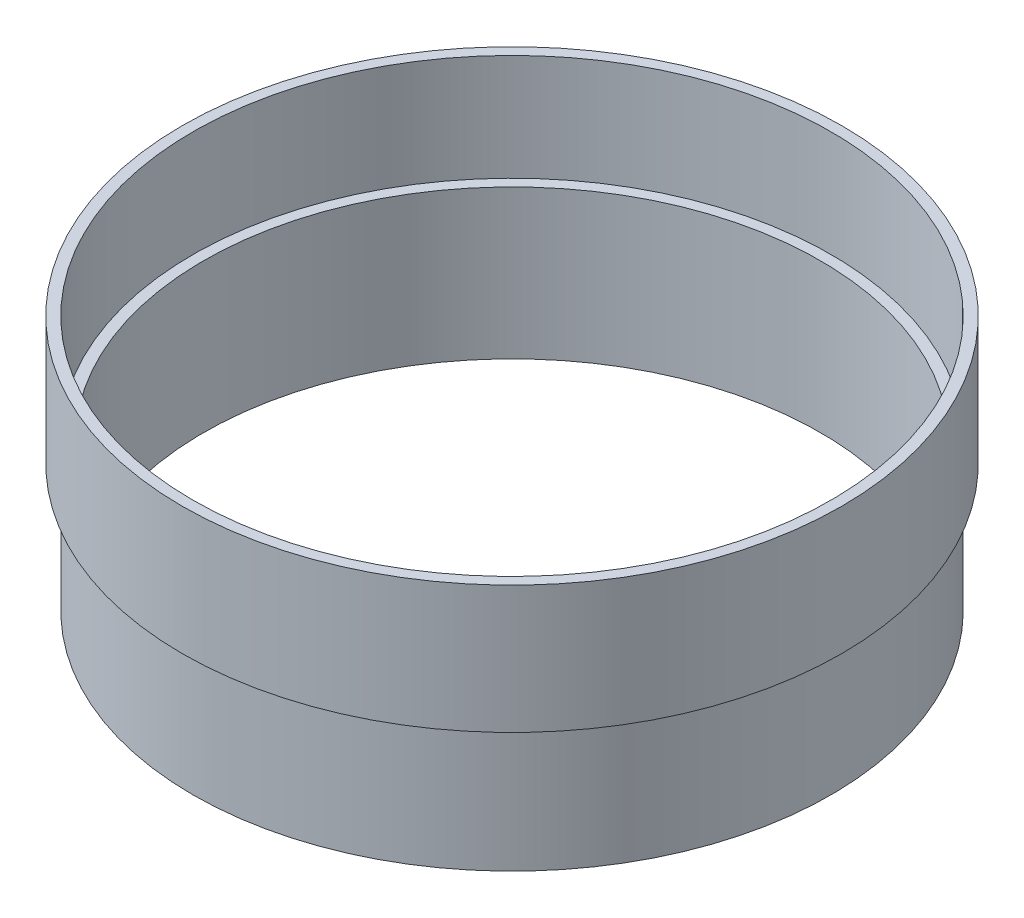
from build123d import *

# Parameters (mm, degrees)
SKETCH1_R           = 15
SKETCH1_R_2         = 14.5
BOSS_EXTRUDE1_DEPTH = 6
SKETCH2_R           = 15.5
SKETCH2_R_2         = 14.5
BOSS_EXTRUDE2_DEPTH = 1
SKETCH3_R           = 15.5
SKETCH3_R_2         = 15
BOSS_EXTRUDE3_DEPTH = 5


with BuildPart() as part:
    # Sketch1 → Boss-Extrude1 (new body)
    with BuildSketch(Plane(origin=(0, 0, 0), x_dir=(1, 0, 0), z_dir=(0, 1, 0))):
        with Locations(Location((0, 0, 0), (0, 0, 270))):
            Circle(SKETCH1_R)
        with Locations(Location((0, 0, 0), (0, 0, 270))):
            Circle(SKETCH1_R_2, mode=Mode.SUBTRACT)
    extrude(amount=BOSS_EXTRUDE1_DEPTH)

    # Sketch2 → Boss-Extrude2 (add)
    with BuildSketch(Plane(origin=(0, 6, 0), x_dir=(1, 0, 0), z_dir=(0, 1, 0))):
        with Locations(Location((0, 0, 0), (0, 0, 270))):
            Circle(SKETCH2_R)
        with Locations(Location((0, 0, 0), (0, 0, 270))):
            Circle(SKETCH2_R_2, mode=Mode.SUBTRACT)
    extrude(amount=BOSS_EXTRUDE2_DEPTH)

    # Sketch3 → Boss-Extrude3 (add)
    with BuildSketch(Plane(origin=(0, 7, 0), x_dir=(1, 0, 0), z_dir=(0, 1, 0))):
        with Locations(Location((0, 0, 0), (0, 0, 270))):
            Circle(SKETCH3_R)
        with Locations(Location((0, 0, 0), (0, 0, 270))):
            Circle(SKETCH3_R_2, mode=Mode.SUBTRACT)
    extrude(amount=BOSS_EXTRUDE3_DEPTH)


solid = part.part
